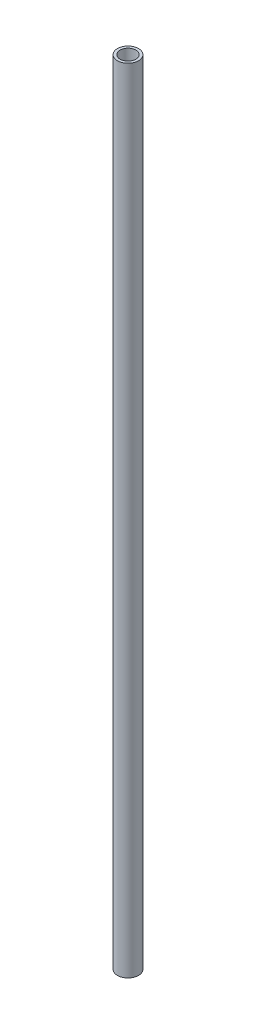
from build123d import *

# Parameters (mm, degrees)
SKETCH1_R           = 2
SKETCH1_R_2         = 1.5
BOSS_EXTRUDE1_DEPTH = 150


with BuildPart() as part:
    # Sketch1 → Boss-Extrude1 (new body)
    with BuildSketch(Plane(origin=(0, 0, 0), x_dir=(1, 0, 0), z_dir=(0, 1, 0))):
        with Locations(Location((0, 0, 0), (0, 0, 270))):
            Circle(SKETCH1_R)
        with Locations(Location((0, 0, 0), (0, 0, 270))):
            Circle(SKETCH1_R_2, mode=Mode.SUBTRACT)
    extrude(amount=BOSS_EXTRUDE1_DEPTH)


solid = part.part
